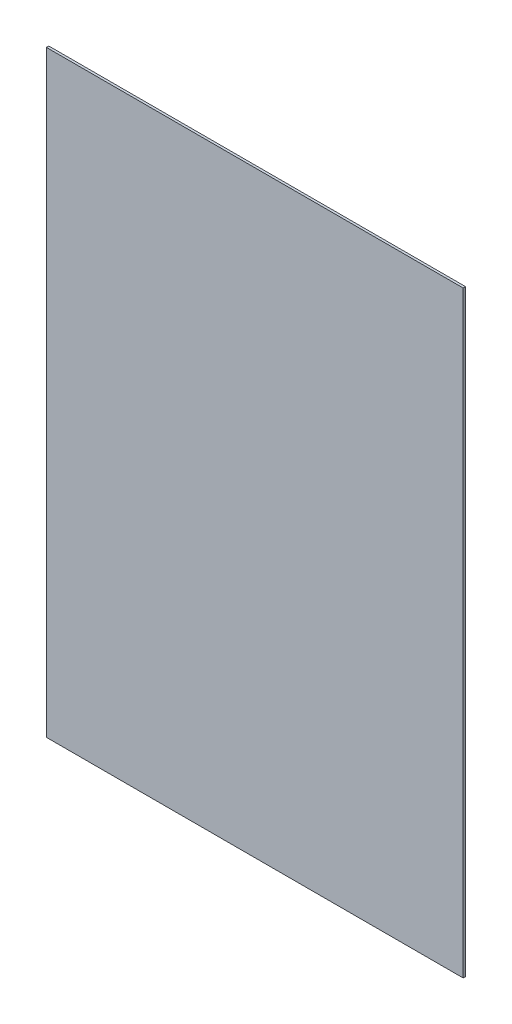
from build123d import *

# Parameters (mm, degrees)
ESQUISSE1_W        = 139.5
ESQUISSE1_H        = 200
BOSS_EXTRU_1_DEPTH = 0.8


with BuildPart() as part:
    # Esquisse1 → Boss.-Extru.1 (new body)
    with BuildSketch(Plane.XY):
        with Locations((69.75, 100)):
            Rectangle(ESQUISSE1_W, ESQUISSE1_H)
    extrude(amount=BOSS_EXTRU_1_DEPTH)


solid = part.part
